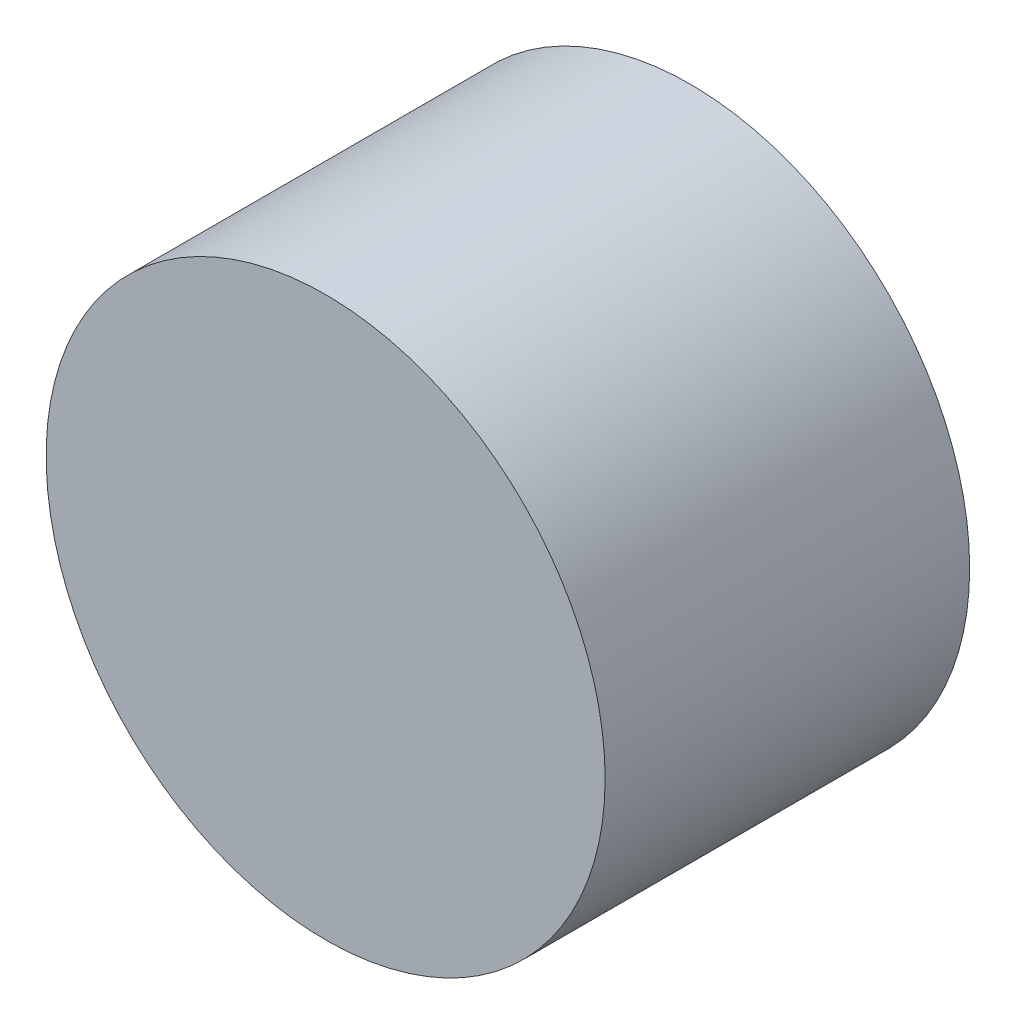
from build123d import *

# Parameters (mm, degrees)
SKETCH1_R           = 11.5
BOSS_EXTRUDE1_DEPTH = 15


with BuildPart() as part:
    # Sketch1 → Boss-Extrude1 (new body)
    with BuildSketch(Plane.XY):
        Circle(SKETCH1_R)
    extrude(amount=BOSS_EXTRUDE1_DEPTH)


solid = part.part
